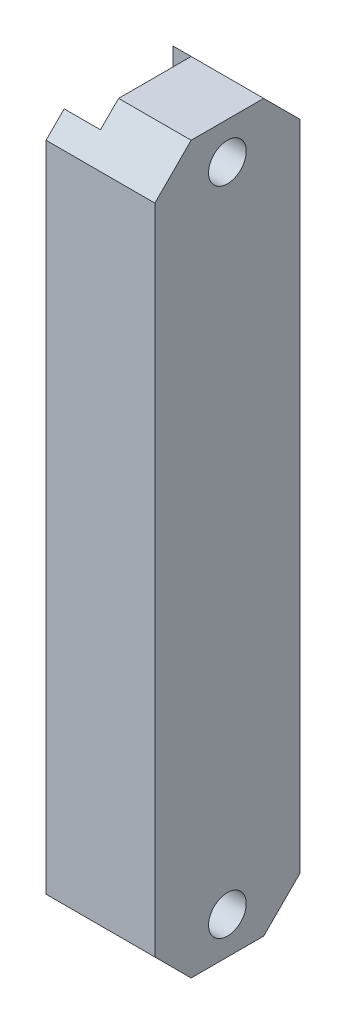
from build123d import *

# Parameters (mm, degrees)
EXTRUDE_1_DEPTH          = 100
CUT_EXTRUDE_1_DEPTH      = 101.995049384
CUT_EXTRUDE_1_DEPTH_BACK = 101.995049384
SKETCH_2_R               = 2.6


with BuildPart() as part:
    # 草图1 → 凸台-拉伸1 (new body)
    with BuildSketch(Plane(origin=(0, 0, 0), x_dir=(1, 0, 0), z_dir=(0, 1, 0))):
        Polygon((-5, 7.5), (0, 7.5), (0, -7.5), (-5, -7.5), (-5, -10), (10, -10), (10, 10), (-5, 10), align=None)
    extrude(amount=EXTRUDE_1_DEPTH)

    # 草图2 → 切除-拉伸1 (cut, two sides: drawn at the far end of the back side and taken through both)
    with BuildSketch(Plane.ZY.offset(-CUT_EXTRUDE_1_DEPTH_BACK)):
        with Locations((0, 94.901280605)):
            Circle(SKETCH_2_R)
        with Locations((0, 5.098719395)):
            Circle(SKETCH_2_R)
        Polygon((-5, 100), (-10, 95), (-10, 100), align=None)
        Polygon((10, 100), (5, 100), (10, 95), align=None)
        Polygon((-10, 0), (-5, 0), (-10, 5), align=None)
        Polygon((10, 5), (10, 0), (5, 0), align=None)
    extrude(amount=CUT_EXTRUDE_1_DEPTH + CUT_EXTRUDE_1_DEPTH_BACK, mode=Mode.SUBTRACT)


solid = part.part
